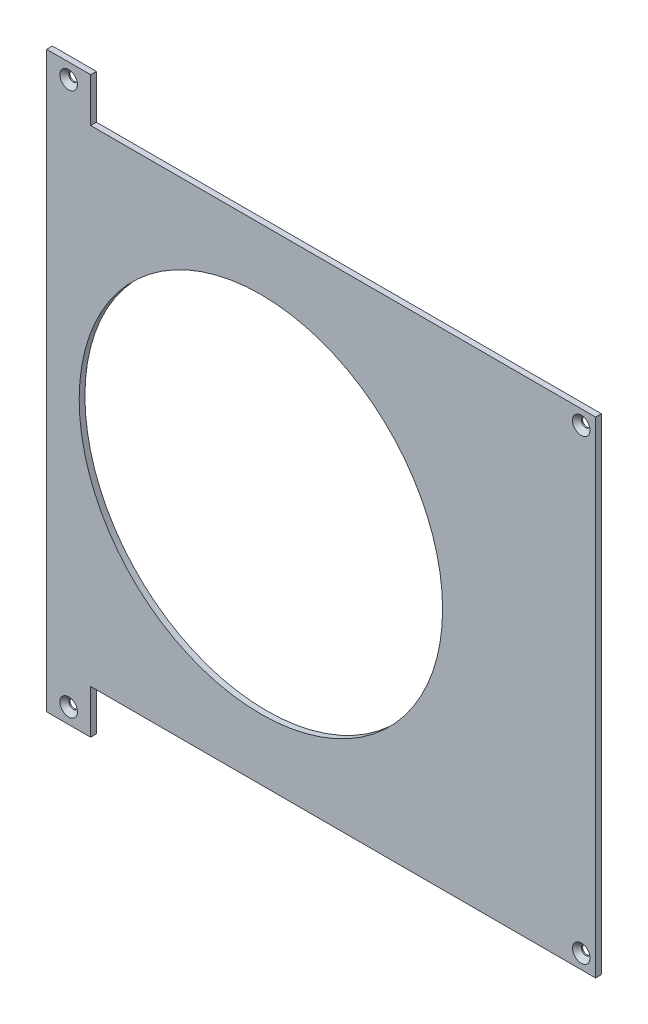
from build123d import *

# Parameters (mm, degrees)
AUFSATZ_LINEAR_AUSTRAGEN1_DEPTH             = 3
FORMSENKUNG_F_R_M4_SENKSCHRAUBE_MIT_2_COUNT = 2
FORMSENKUNG_F_R_M4_SENKSCHRAUBE_MIT_2_PITCH = 284
FORMSENKUNG_F_R_M4_SENKSCHRAUBE_MIT_3_COUNT = 2
FORMSENKUNG_F_R_M4_SENKSCHRAUBE_MIT_3_PITCH = 268.942837793
FORMSENKUNG_F_R_M4_SENKSCHRAUBE_MIT_4_COUNT = 2
FORMSENKUNG_F_R_M4_SENKSCHRAUBE_MIT_4_PITCH = 374.441250399
SKIZZE4_R                                   = 95
SCHNITT_LINEAR_AUSTRAGEN1_DEPTH             = 10


with BuildPart() as part:
    # Skizze1 → Aufsatz-Linear austragen1 (new body)
    with BuildSketch(Plane.XY):
        Polygon((15.000749991, 0), (15.000749991, -300), (38.000749991, -300), (38.000749991, -277), (302.000749991, -277), (302.000749991, -23), (38.000749991, -23), (38.000749991, 0), align=None)
    extrude(amount=AUFSATZ_LINEAR_AUSTRAGEN1_DEPTH)

    # Skizze3 → Formsenkung für M4 Senkschraube mit Innensechskant1 (revolve, cut)
    with BuildSketch(Plane(origin=(26.500749991, -8, 3), x_dir=(0, -1, 0), z_dir=(1, 0, 0))):
        Polygon((0, 0), (0, 3), (2.25, 3), (2.25, 2.34), (4.59, 0), align=None)
    formsenkung_f_r_m4_senkschraube_mit_inne = revolve(axis=Axis((26.500749991, -8, 9.35), (0, 0, -1)), mode=Mode.SUBTRACT)

    # Formsenkung f_r M4 Senkschraube mit  2: Formsenkung für M4 Senkschraube mit Innensechskant1 ×2
    with Locations(*[(0, -i * FORMSENKUNG_F_R_M4_SENKSCHRAUBE_MIT_2_PITCH, 0) for i in range(1, FORMSENKUNG_F_R_M4_SENKSCHRAUBE_MIT_2_COUNT)]):
        add(formsenkung_f_r_m4_senkschraube_mit_inne, mode=Mode.SUBTRACT)

    # Formsenkung f_r M4 Senkschraube mit  3: Formsenkung für M4 Senkschraube mit Innensechskant1 ×2
    with Locations(*[Vector(0.9964942818315755, -0.08366090052690477, 0) * (i * FORMSENKUNG_F_R_M4_SENKSCHRAUBE_MIT_3_PITCH) for i in range(1, FORMSENKUNG_F_R_M4_SENKSCHRAUBE_MIT_3_COUNT)]):
        add(formsenkung_f_r_m4_senkschraube_mit_inne, mode=Mode.SUBTRACT)

    # Formsenkung f_r M4 Senkschraube mit  4: Formsenkung für M4 Senkschraube mit Innensechskant1 ×2
    with Locations(*[Vector(0.7157331082373348, -0.6983739097166529, 0) * (i * FORMSENKUNG_F_R_M4_SENKSCHRAUBE_MIT_4_PITCH) for i in range(1, FORMSENKUNG_F_R_M4_SENKSCHRAUBE_MIT_4_COUNT)]):
        add(formsenkung_f_r_m4_senkschraube_mit_inne, mode=Mode.SUBTRACT)

    # Skizze4 → Schnitt-Linear austragen1 (cut)
    with BuildSketch(Plane.XY.offset(3)):
        with Locations((127.000749991, -150)):
            Circle(SKIZZE4_R)
    extrude(amount=-SCHNITT_LINEAR_AUSTRAGEN1_DEPTH, mode=Mode.SUBTRACT)


solid = part.part
